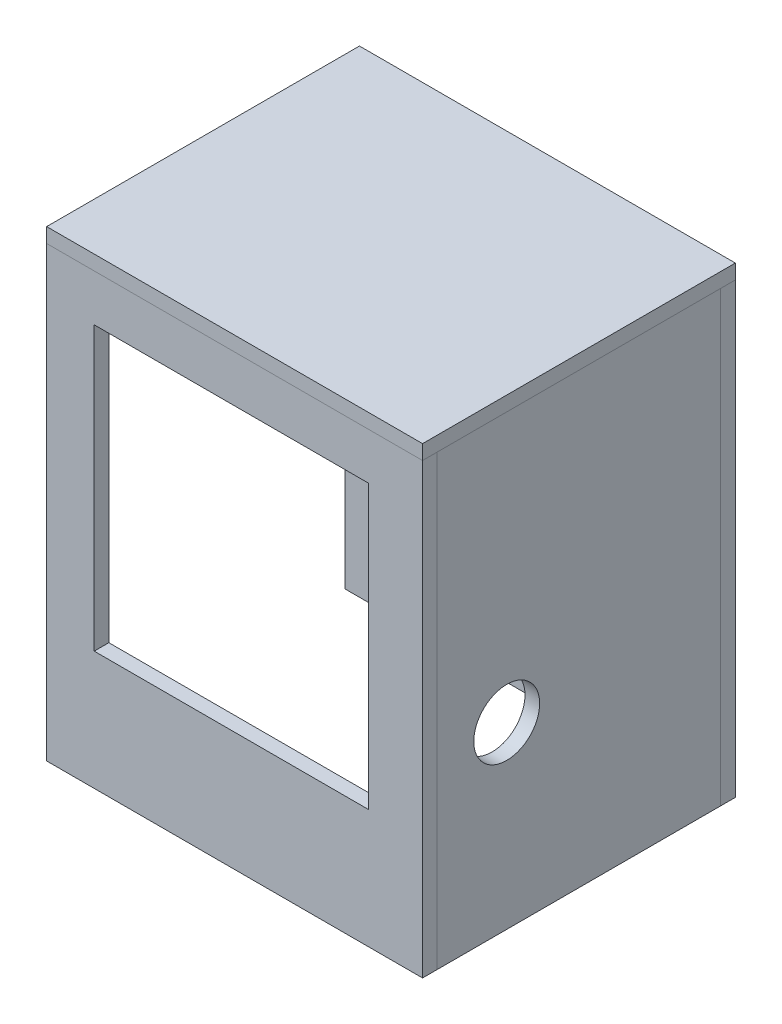
from build123d import *

# Parameters (mm, degrees)
SKETCH1_W           = 658.8125
SKETCH1_H           = 777.875
BOSS_EXTRUDE1_DEPTH = 25.4
SKETCH2_W           = 25.4
SKETCH2_H           = 777.875
BOSS_EXTRUDE2_DEPTH = 492.125
SKETCH3_W           = 658.8125
SKETCH3_H           = 777.875
BOSS_EXTRUDE3_DEPTH = 25.4
SKETCH4_W           = 658.8125
SKETCH4_H           = 542.925
BOSS_EXTRUDE4_DEPTH = 25.4
SKETCH5_W           = 542.925
SKETCH5_H           = 803.275
CUT_EXTRUDE1_DEPTH  = 6.35
SKETCH6_W           = 476.25
SKETCH6_H           = 490.5375
CUT_EXTRUDE2_DEPTH  = 25.4
SKETCH7_R           = 57.15
CUT_EXTRUDE3_DEPTH  = 25.4


with BuildPart() as part:
    # Sketch1 → Boss-Extrude1 (new body)
    with BuildSketch(Plane.XY):
        with Locations((329.40625, 388.9375)):
            Rectangle(SKETCH1_W, SKETCH1_H)
    extrude(amount=BOSS_EXTRUDE1_DEPTH)


with BuildPart() as body_2:
    # Sketch2 → Boss-Extrude2 (new body)
    with BuildSketch(Plane(origin=(0, 0, 0), x_dir=(-1, 0, 0), z_dir=(0, 0, -1))):
        with Locations((-646.1125, 388.9375)):
            Rectangle(SKETCH2_W, SKETCH2_H)
    extrude(amount=BOSS_EXTRUDE2_DEPTH)

    # Sketch7 → Cut-Extrude3 (cut)
    with BuildSketch(Plane(origin=(658.8125, 0, 0), x_dir=(0, 0, -1), z_dir=(1, 0, 0))):
        with Locations((120.65, 311.15)):
            Circle(SKETCH7_R)
    extrude(amount=-CUT_EXTRUDE3_DEPTH, mode=Mode.SUBTRACT)


with BuildPart() as body_3:
    # Sketch3 → Boss-Extrude3 (new body)
    with BuildSketch(Plane(origin=(0, 0, -492.125), x_dir=(-1, 0, 0), z_dir=(0, 0, -1))):
        with Locations((-329.40625, 388.9375)):
            Rectangle(SKETCH3_W, SKETCH3_H)
    extrude(amount=BOSS_EXTRUDE3_DEPTH)


with BuildPart() as body_4:
    # Sketch4 → Boss-Extrude4 (new body)
    with BuildSketch(Plane(origin=(0, 777.875, 0), x_dir=(1, 0, 0), z_dir=(0, 1, 0))):
        with Locations((329.40625, 246.0625)):
            Rectangle(SKETCH4_W, SKETCH4_H)
    extrude(amount=BOSS_EXTRUDE4_DEPTH)


with BuildPart() as cut_extrude1_tool:
    # Sketch5 → Cut-Extrude1 (new body)
    with BuildSketch(Plane.ZY):
        with Locations((-246.0625, 401.6375)):
            Rectangle(SKETCH5_W, SKETCH5_H)
    extrude(amount=-CUT_EXTRUDE1_DEPTH)


with BuildPart() as part_1:
    add(part.part)

    # Cut-Extrude1: cut by cut_extrude1_tool
    add(cut_extrude1_tool.part, mode=Mode.SUBTRACT)

    # Sketch6 → Cut-Extrude2 (cut)
    with BuildSketch(Plane.XY.offset(25.4)):
        with Locations((327.025, 451.64375)):
            Rectangle(SKETCH6_W, SKETCH6_H)
    extrude(amount=-CUT_EXTRUDE2_DEPTH, mode=Mode.SUBTRACT)


with BuildPart() as body_3_1:
    add(body_3.part)

    # Cut-Extrude1: cut by cut_extrude1_tool
    add(cut_extrude1_tool.part, mode=Mode.SUBTRACT)


with BuildPart() as body_4_1:
    add(body_4.part)

    # Cut-Extrude1: cut by cut_extrude1_tool
    add(cut_extrude1_tool.part, mode=Mode.SUBTRACT)


solid = Compound([body_2.part, part_1.part, body_3_1.part, body_4_1.part])
